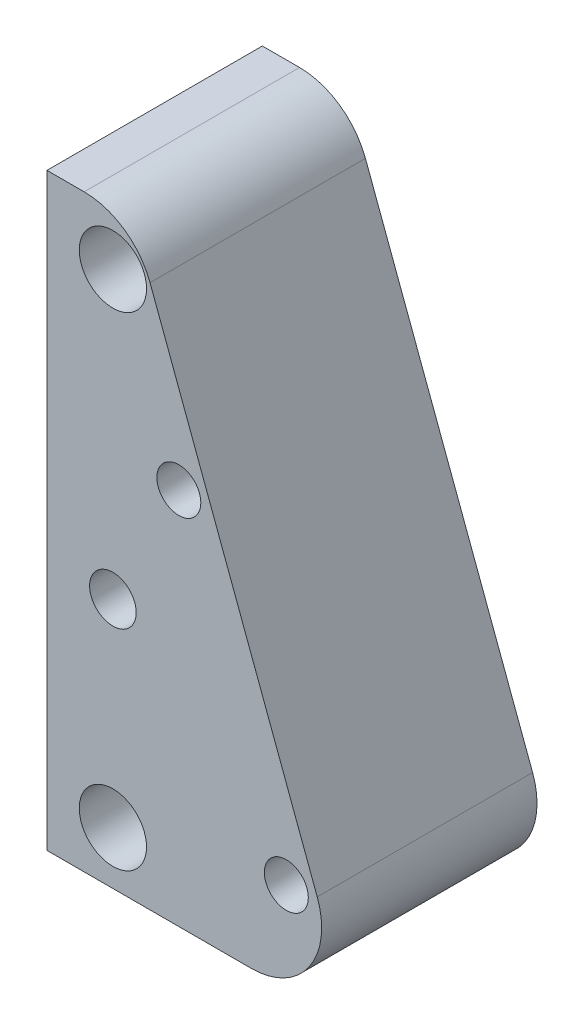
from build123d import *

# Parameters (mm, degrees)
SZKIC1_R                    = 7.65
SZKIC1_R_2                  = 5.3
SZKIC1_R_3                  = 5
DODANIE_WYCI_GNI_CIE1_DEPTH = 49
ZAOKR_GLENIE1_R             = 16
SZKIC2_R                    = 11
WYTNIJ_WYCI_GNI_CIE1_DEPTH  = 4
SZKIC3_R                    = 1.21
WYTNIJ_WYCI_GNI_CIE2_DEPTH  = 15


with BuildPart() as part:
    # Szkic1 → Dodanie-wyciągnięcie1 (new body)
    with BuildSketch(Plane.XY):
        Polygon((-15, -57), (-15, 77), (4.572094065, 77), (54.539400892, -57), align=None)
        with Locations((0, 65)):
            Circle(SZKIC1_R, mode=Mode.SUBTRACT)
        with Locations((0, -45)):
            Circle(SZKIC1_R, mode=Mode.SUBTRACT)
        Circle(SZKIC1_R_2, mode=Mode.SUBTRACT)
        with Locations((15, 29)):
            Circle(SZKIC1_R_3, mode=Mode.SUBTRACT)
        with Locations((39.457289313, -36.58842123)):
            Circle(SZKIC1_R_3, mode=Mode.SUBTRACT)
    extrude(amount=DODANIE_WYCI_GNI_CIE1_DEPTH)

    # Zaokrąglenie1
    zaokr_glenie1_edges = [part.edges().sort_by_distance(p)[0] for p in [
        (4.572094065, 77, 24.5),
        (54.539400892, -57, 24.5),
    ]]
    fillet(zaokr_glenie1_edges, radius=ZAOKR_GLENIE1_R)

    # Szkic2 → Wytnij-wyciągnięcie1 (cut)
    with BuildSketch(Plane(origin=(0, 0, 0), x_dir=(-1, 0, 0), z_dir=(0, 0, -1))):
        Circle(SZKIC2_R)
    extrude(amount=-WYTNIJ_WYCI_GNI_CIE1_DEPTH, mode=Mode.SUBTRACT)

    # Szkic3 → Wytnij-wyciągnięcie2 (cut)
    with BuildSketch(Plane(origin=(0, 0, 4), x_dir=(-1, 0, 0), z_dir=(0, 0, -1))):
        with Locations((0, 8)):
            Circle(SZKIC3_R)
        with Locations((8, 0)):
            Circle(SZKIC3_R)
        with Locations((0, -8)):
            Circle(SZKIC3_R)
        with Locations((-8, 0)):
            Circle(SZKIC3_R)
    extrude(amount=-WYTNIJ_WYCI_GNI_CIE2_DEPTH, mode=Mode.SUBTRACT)


solid = part.part
